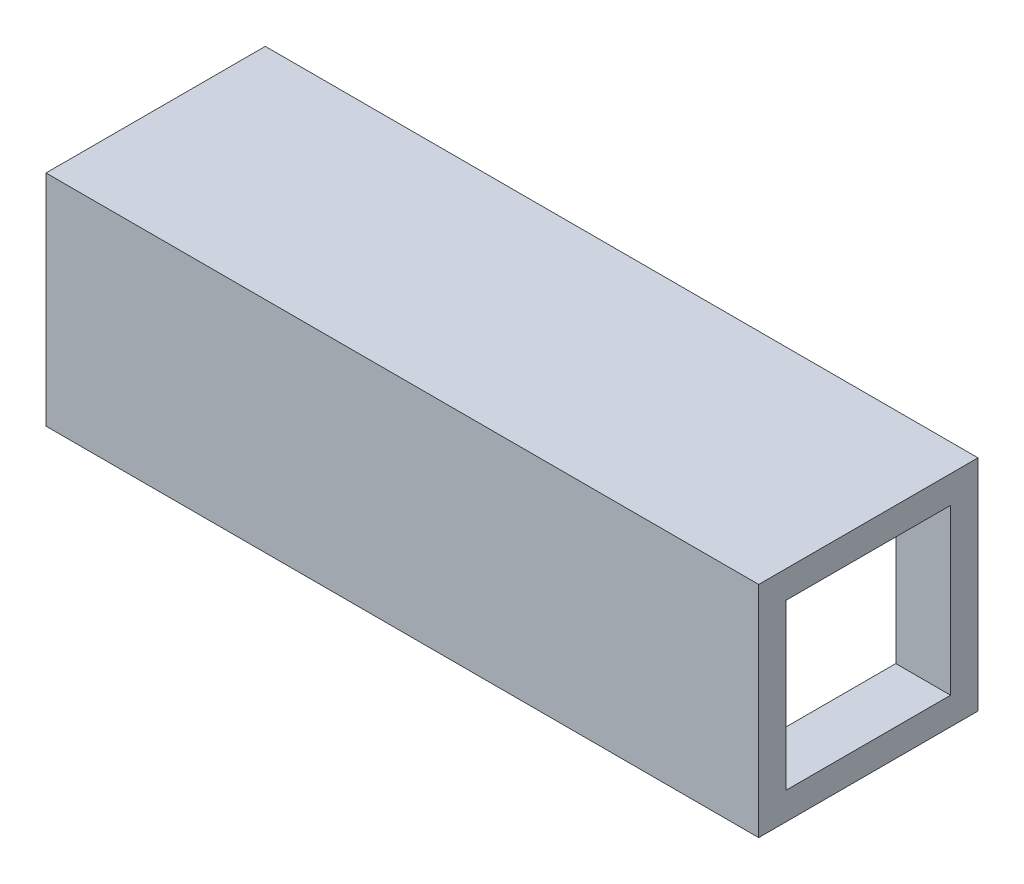
from build123d import *

# Parameters (mm, degrees)
SKETCH2_W           = 25.4
SKETCH2_H           = 25.4
SKETCH2_W_2         = 19.05
SKETCH2_H_2         = 19.05
BOSS_EXTRUDE1_DEPTH = 82.55
CUT_EXTRUDE1_REACH  = 89.298
SKETCH3_W           = 27.94
SKETCH3_H           = 22.225


with BuildPart() as part:
    # Sketch2 → Boss-Extrude1 (new body)
    with BuildSketch(Plane(origin=(0, 0, 0), x_dir=(0, 0, -1), z_dir=(1, 0, 0))):
        Rectangle(SKETCH2_W, SKETCH2_H)
        Rectangle(SKETCH2_W_2, SKETCH2_H_2, mode=Mode.SUBTRACT)
    extrude(amount=BOSS_EXTRUDE1_DEPTH)

    # Cut-Extrude1: up to this face of the body (flat: up to its plane)
    cut_extrude1_end = Plane(part.part.faces().sort_by_distance((41.275, 0, 9.525))[0])
    # Sketch3 → Cut-Extrude1 (cut, up to the picked face)
    with BuildSketch(Plane(origin=(0, 0, -12.7), x_dir=(-1, 0, 0), z_dir=(0, 0, -1)), mode=Mode.PRIVATE) as cut_extrude1_sk1:
        with Locations((-62.23, -1.5875)):
            Rectangle(SKETCH3_W, SKETCH3_H)
    cut_extrude1_tool1 = split(extrude(cut_extrude1_sk1.sketch, amount=-CUT_EXTRUDE1_REACH, mode=Mode.PRIVATE), bisect_by=cut_extrude1_end, keep=Keep.BOTH, mode=Mode.PRIVATE)
    add(cut_extrude1_tool1.solids().sort_by(Axis((62.23, -1.5875, -12.7), (0, 0, 1)))[0], mode=Mode.SUBTRACT)


solid = part.part
